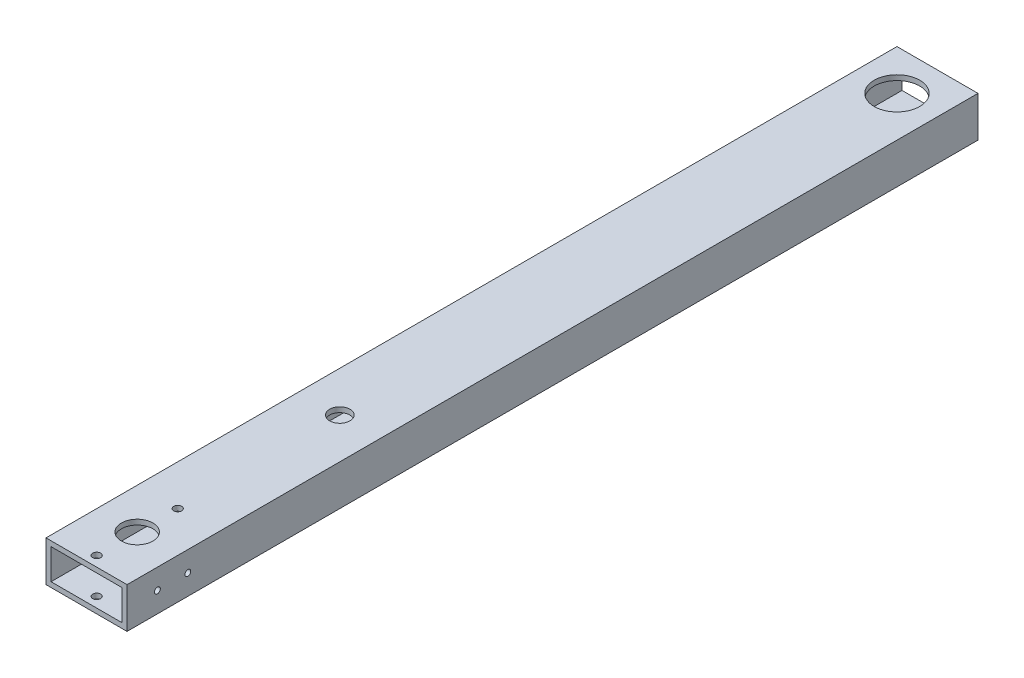
from build123d import *

# Parameters (mm, degrees)
SKETCH1_W                   = 50.8
SKETCH1_H                   = 25.4
BOSS_EXTRUDE1_DEPTH         = 266.7
SKETCH2_W                   = 44.45
SKETCH2_H                   = 19.05
CUT_EXTRUDE1_DEPTH          = 535.155417458
SKETCH5_R                   = 2.4892
SKETCH5_R_2                 = 9.84885
SKETCH5_R_3                 = 14.2875
CUT_EXTRUDE2_DEPTH          = 508
SKETCH7_R                   = 6.35
CUT_EXTRUDE4_DEPTH          = 270.108175275
F_27_0_144_DIAMETER_HOLE1_D = 3.6576


with BuildPart() as part:
    # Sketch1 → Boss-Extrude1 (new, symmetric)
    with BuildSketch(Plane.XY):
        Rectangle(SKETCH1_W, SKETCH1_H)
    extrude(amount=BOSS_EXTRUDE1_DEPTH, both=True)

    # Sketch2 → Cut-Extrude1 (cut, through all)
    with BuildSketch(Plane.XY.offset(266.7)):
        Rectangle(SKETCH2_W, SKETCH2_H)
    extrude(amount=-CUT_EXTRUDE1_DEPTH, mode=Mode.SUBTRACT)

    # Sketch5 → Cut-Extrude2 (cut)
    with BuildSketch(Plane(origin=(0, 12.7, 0), x_dir=(1, 0, 0), z_dir=(0, 1, 0))):
        with Locations(Location((0, -260.35, 0), (0, 0, 270))):
            Circle(SKETCH5_R)
        with Locations(Location((0, -234.95, 0), (0, 0, 270))):
            Circle(SKETCH5_R_2)
        with Locations(Location((0, -209.55, 0), (0, 0, 270))):
            Circle(SKETCH5_R)
        with Locations(Location((0, 241.3, 0), (0, 0, 270))):
            Circle(SKETCH5_R_3)
    extrude(amount=-CUT_EXTRUDE2_DEPTH, mode=Mode.SUBTRACT)

    # Sketch7 → Cut-Extrude4 (cut, through all)
    with BuildSketch(Plane(origin=(0, 12.7, 0), x_dir=(1, 0, 0), z_dir=(0, 1, 0))):
        with Locations(Location((0, -107.95, 0), (0, 0, 270))):
            Circle(SKETCH7_R)
    extrude(amount=-CUT_EXTRUDE4_DEPTH, mode=Mode.SUBTRACT)

    # #27 (0.144) Diameter Hole1 (through all)
    with Locations(Plane(origin=(25.4, 0, 0), x_dir=(0, 0, -1), z_dir=(1, 0, 0))):
        with Locations((-247.65, 0), (-228.6, 0)):
            Hole(F_27_0_144_DIAMETER_HOLE1_D / 2)


solid = part.part
